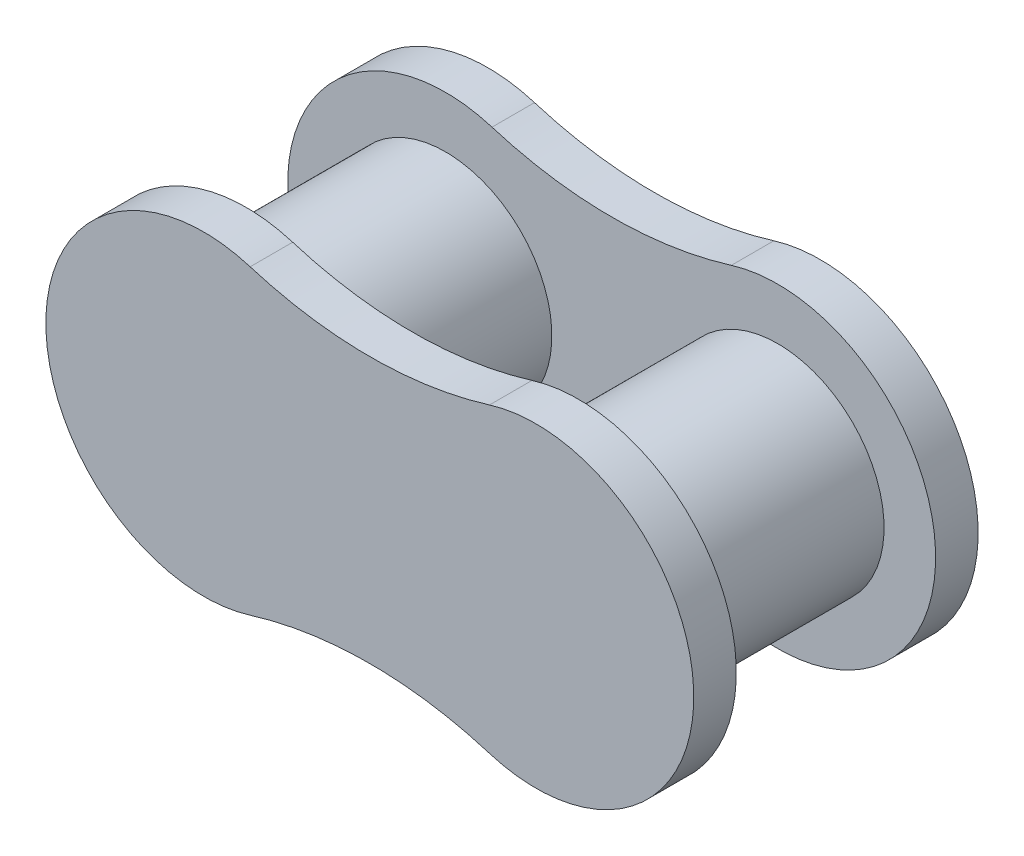
from build123d import *

# Parameters (mm, degrees)
BOSS_EXTRUDE1_DEPTH = 2.032
SKETCH4_R           = 5.08
BOSS_EXTRUDE2_DEPTH = 9.525


with BuildPart() as part:
    # Sketch2 → Boss-Extrude1 (new body)
    with BuildSketch(Plane.XY):
        with BuildLine():
            ThreePointArc((-5.718518673, 7.210065208), (-15.4813, 0), (-5.718518673, -7.210065208))
            ThreePointArc((-5.718518673, -7.210065208), (0, -6.35), (5.718518673, -7.210065208))
            ThreePointArc((5.718518673, -7.210065208), (15.4813, 0), (5.718518673, 7.210065208))
            ThreePointArc((5.718518673, 7.210065208), (0, 6.35), (-5.718518673, 7.210065208))
        make_face()
    boss_extrude1 = extrude(amount=BOSS_EXTRUDE1_DEPTH)

    # Sketch4 → Boss-Extrude2 (add)
    with BuildSketch(Plane.XY.offset(2.032)):
        with Locations(Location((-7.9375, 0, 0), (0, 0, 180))):
            Circle(SKETCH4_R)
        with Locations(Location((7.9375, 0, 0), (0, 0, 180))):
            Circle(SKETCH4_R)
    extrude(amount=BOSS_EXTRUDE2_DEPTH)

    # Mirror1: Boss-Extrude1 across plane
    add(boss_extrude1.mirror(Plane.XY.offset(6.7945)))


solid = part.part
